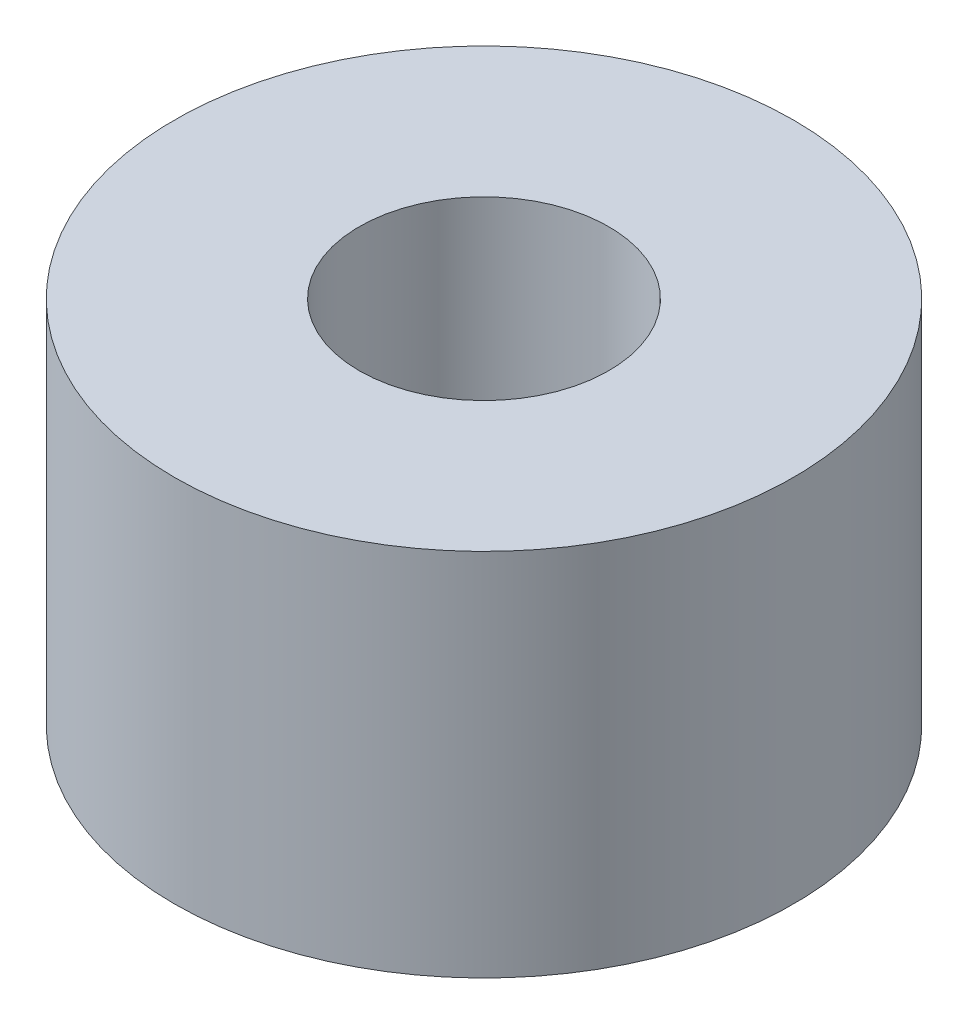
from build123d import *

# Parameters (mm, degrees)
SKETCH2_R           = 8.3782
SKETCH2_R_2         = 3.3782
BOSS_EXTRUDE1_DEPTH = 10


with BuildPart() as part:
    # Sketch2 → Boss-Extrude1 (new body)
    with BuildSketch(Plane(origin=(0, 0, 0), x_dir=(1, 0, 0), z_dir=(0, 1, 0))):
        with Locations(Location((0, 0, 0), (0, 0, 270))):
            Circle(SKETCH2_R)
        with Locations(Location((0, 0, 0), (0, 0, 270))):
            Circle(SKETCH2_R_2, mode=Mode.SUBTRACT)
    extrude(amount=BOSS_EXTRUDE1_DEPTH)


solid = part.part
